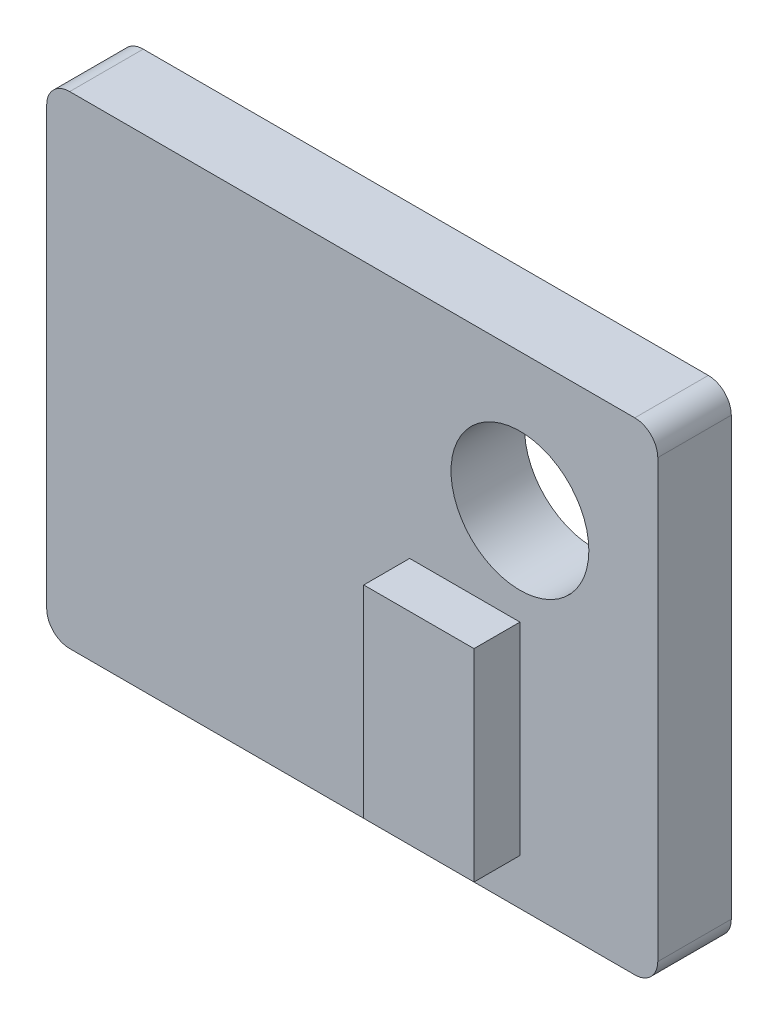
from build123d import *

# Parameters (mm, degrees)
SKETCH1_W           = 13.3
SKETCH1_H           = 10.5
BOSS_EXTRUDE1_DEPTH = 1.6
SKETCH2_R           = 1.5
CUT_EXTRUDE1_DEPTH  = 1.6
SKETCH3_W           = 2.4
SKETCH3_H           = 4.4
BOSS_EXTRUDE2_DEPTH = 1
FILLET1_R           = 0.5


with BuildPart() as part:
    # Sketch1 → Boss-Extrude1 (new body)
    with BuildSketch(Plane.XY):
        Rectangle(SKETCH1_W, SKETCH1_H)
    extrude(amount=BOSS_EXTRUDE1_DEPTH)

    # Sketch2 → Cut-Extrude1 (cut)
    with BuildSketch(Plane.XY.offset(1.6)):
        with Locations((3.65, 2.25)):
            Circle(SKETCH2_R)
    extrude(amount=-CUT_EXTRUDE1_DEPTH, mode=Mode.SUBTRACT)

    # Sketch3 → Boss-Extrude2 (add)
    with BuildSketch(Plane.XY.offset(1.6)):
        with Locations((2.45, -2.05)):
            Rectangle(SKETCH3_W, SKETCH3_H)
    extrude(amount=BOSS_EXTRUDE2_DEPTH)

    # Fillet1
    fillet1_edges = [part.edges().sort_by_distance(p)[0] for p in [
        (-6.65, 5.25, 0.8),
        (6.65, 5.25, 0.8),
        (6.65, -5.25, 0.8),
        (-6.65, -5.25, 0.8),
    ]]
    fillet(fillet1_edges, radius=FILLET1_R)


solid = part.part
